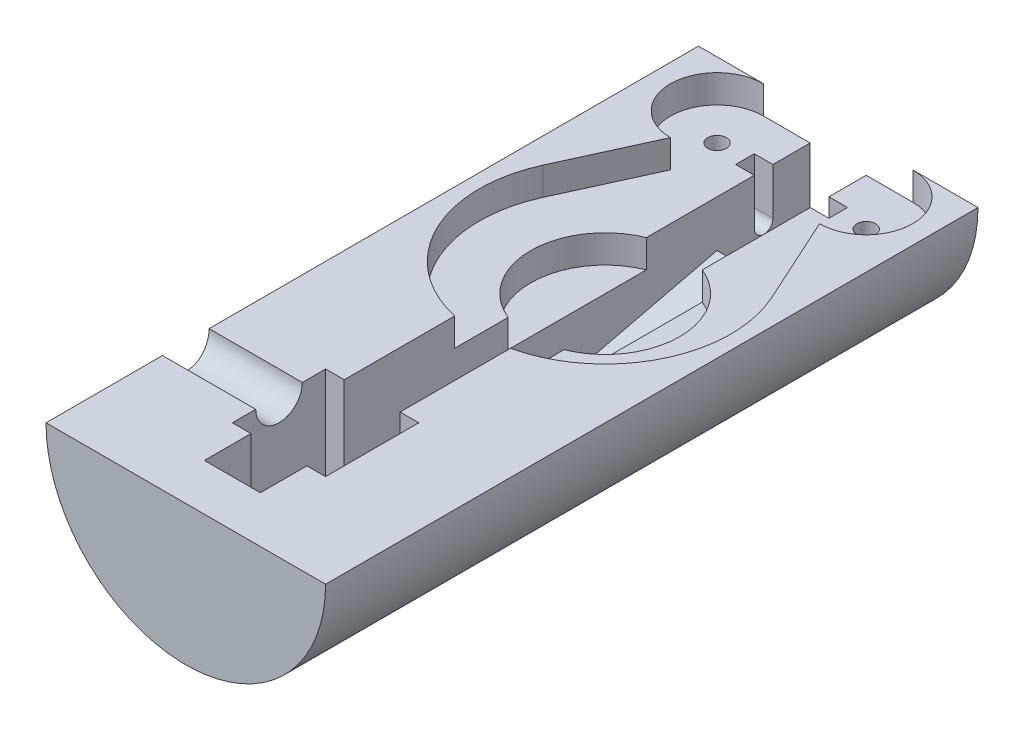
from build123d import *

# Parameters (mm, degrees)
SALIENTE_EXTRUIR1_DEPTH      = 35
SALIENTE_EXTRUIR1_DEPTH_BACK = 35
CORTAR_EXTRUIR1_DEPTH        = 3
CROQUIS4_R                   = 8
CORTAR_EXTRUIR2_DEPTH        = 3
CROQUIS5_R                   = 2.5
CORTAR_EXTRUIR3_DEPTH        = 10
CROQUIS6_W                   = 6
CROQUIS6_H                   = 10
CORTAR_EXTRUIR5_DEPTH        = 10
CROQUIS7_W                   = 2
CROQUIS7_H                   = 2
CORTAR_EXTRUIR6_DEPTH        = 5
CROQUIS8_R                   = 1
CORTAR_EXTRUIR7_DEPTH        = 2
CROQUIS9_W                   = 6
CROQUIS9_H                   = 10
CORTAR_EXTRUIR8_DEPTH        = 12
CORTAR_EXTRUIR9_DEPTH        = 5
CORTAR_EXTRUIR9_DEPTH_BACK   = 5
CROQUIS10_R                  = 1
CORTAR_EXTRUIR10_DEPTH       = 5
CORTAR_EXTRUIR10_DEPTH_BACK  = 5
CORTAR_EXTRUIR11_DEPTH       = 3
CORTAR_EXTRUIR11_DEPTH_BACK  = 3
CROQUIS15_R                  = 2.5
CORTAR_EXTRUIR12_DEPTH       = 15
CROQUIS14_W                  = 2
CROQUIS14_H                  = 10
CORTAR_EXTRUIR13_DEPTH       = 10


with BuildPart() as part:
    # Croquis1 → Saliente-Extruir1 (new, two sides: drawn at the far end of the back side and taken through both)
    with BuildSketch(Plane.XY.offset(-SALIENTE_EXTRUIR1_DEPTH_BACK)):
        with BuildLine():
            Line((-15, 0), (15, 0))
            ThreePointArc((15, 0), (0, -15), (-15, 0))
        make_face()
    extrude(amount=SALIENTE_EXTRUIR1_DEPTH + SALIENTE_EXTRUIR1_DEPTH_BACK)

    # Croquis3 → Cortar-Extruir1 (cut)
    with BuildSketch(Plane(origin=(0, 0, 0), x_dir=(1, 0, 0), z_dir=(0, 1, 0))):
        with BuildLine():
            Line((-8, 25), (-12.284525276, 15.598253186))
            ThreePointArc((-12.284525276, 15.598253186), (0, -3.5), (12.284525276, 15.598253186))
            Line((12.284525276, 15.598253186), (8, 25))
            ThreePointArc((8, 25), (13, 30), (8, 35))
            Line((8, 35), (-8, 35))
            ThreePointArc((-8, 35), (-13, 30), (-8, 25))
        make_face()
    extrude(amount=-CORTAR_EXTRUIR1_DEPTH, mode=Mode.SUBTRACT)

    # Croquis4 → Cortar-Extruir2 (cut)
    with BuildSketch(Plane(origin=(0, -3, 0), x_dir=(1, 0, 0), z_dir=(0, 1, 0))):
        with Locations((0, 10)):
            Circle(CROQUIS4_R)
    extrude(amount=-CORTAR_EXTRUIR2_DEPTH, mode=Mode.SUBTRACT)

    # Croquis5 → Cortar-Extruir3 (cut)
    with BuildSketch(Plane(origin=(0, -6, 0), x_dir=(1, 0, 0), z_dir=(0, 1, 0))):
        with Locations((0, 10)):
            Circle(CROQUIS5_R)
    extrude(amount=-CORTAR_EXTRUIR3_DEPTH, mode=Mode.SUBTRACT)

    # Croquis6 → Cortar-Extruir5 (cut)
    with BuildSketch(Plane(origin=(0, -3, 0), x_dir=(1, 0, 0), z_dir=(0, 1, 0))):
        with Locations((0, 30)):
            Rectangle(CROQUIS6_W, CROQUIS6_H)
    extrude(amount=-CORTAR_EXTRUIR5_DEPTH, mode=Mode.SUBTRACT)

    # Croquis7 → Cortar-Extruir6 (cut)
    with BuildSketch(Plane(origin=(0, -3, 0), x_dir=(1, 0, 0), z_dir=(0, 1, 0))):
        with Locations((-4, 30)):
            Rectangle(CROQUIS7_W, CROQUIS7_H)
        with Locations((4, 30)):
            Rectangle(CROQUIS7_W, CROQUIS7_H)
    extrude(amount=-CORTAR_EXTRUIR6_DEPTH, mode=Mode.SUBTRACT)

    # Croquis8 → Cortar-Extruir7 (cut)
    with BuildSketch(Plane(origin=(0, -3, 0), x_dir=(1, 0, 0), z_dir=(0, 1, 0))):
        with Locations((-8, 30)):
            Circle(CROQUIS8_R)
        with Locations((8, 30)):
            Circle(CROQUIS8_R)
    extrude(amount=-CORTAR_EXTRUIR7_DEPTH, mode=Mode.SUBTRACT)

    # Croquis9 → Cortar-Extruir8 (cut)
    with BuildSketch(Plane(origin=(0, -3, 0), x_dir=(1, 0, 0), z_dir=(0, 1, 0))):
        Rectangle(CROQUIS9_W, CROQUIS9_H)
    extrude(amount=-CORTAR_EXTRUIR8_DEPTH, mode=Mode.SUBTRACT)

    # Croquis10 → Cortar-Extruir9 (cut, two sides: drawn at the far end of the back side and taken through both)
    with BuildSketch(Plane(origin=(0, 0, 0), x_dir=(0, 0, -1), z_dir=(1, 0, 0)).offset(-CORTAR_EXTRUIR9_DEPTH_BACK)):
        with Locations((30, -8)):
            Circle(CROQUIS10_R)
    extrude(amount=CORTAR_EXTRUIR9_DEPTH + CORTAR_EXTRUIR9_DEPTH_BACK, mode=Mode.SUBTRACT)

    # Croquis11 → Cortar-Extruir10 (cut, two sides: drawn at the far end of the back side and taken through both)
    with BuildSketch(Plane(origin=(0, 0, 0), x_dir=(0, 0, -1), z_dir=(1, 0, 0)).offset(-CORTAR_EXTRUIR10_DEPTH_BACK)):
        with BuildLine():
            Line((-6, -15), (6, -15))
            Line((6, -15), (6, -14))
            Line((6, -14), (1, -14))
            Line((1, -14), (1, -8))
            ThreePointArc((1, -8), (0, -7), (-1, -8))
            Line((-1, -8), (-1, -14))
            Line((-1, -14), (-6, -14))
            Line((-6, -14), (-6, -15))
        make_face()
    extrude(amount=CORTAR_EXTRUIR10_DEPTH + CORTAR_EXTRUIR10_DEPTH_BACK, mode=Mode.SUBTRACT)

    # Croquis12 → Cortar-Extruir11 (cut, two sides: drawn at the far end of the back side and taken through both)
    with BuildSketch(Plane(origin=(0, 0, 0), x_dir=(0, 0, -1), z_dir=(1, 0, 0)).offset(-CORTAR_EXTRUIR11_DEPTH_BACK)):
        with BuildLine():
            Line((-3, -13), (-21.658767316, -9.861464952))
            ThreePointArc((-21.658767316, -9.861464952), (-27.635040051, -6.458030924), (-30, 0))
            Line((-30, 0), (-3, 0))
            Line((-3, 0), (-3, -13))
        make_face()
        Polygon((25, -8), (25, -3), (4, -3), (4, -13), align=None)
    extrude(amount=CORTAR_EXTRUIR11_DEPTH + CORTAR_EXTRUIR11_DEPTH_BACK, mode=Mode.SUBTRACT)

    # Croquis15 → Cortar-Extruir12 (cut)
    with BuildSketch(Plane(origin=(0, 0, 0), x_dir=(0, 0, -1), z_dir=(1, 0, 0))):
        with Locations((-20, 0)):
            Circle(CROQUIS15_R)
    extrude(amount=-CORTAR_EXTRUIR12_DEPTH, mode=Mode.SUBTRACT)

    # Croquis14 → Cortar-Extruir13 (cut)
    with BuildSketch(Plane(origin=(0, 0, 0), x_dir=(1, 0, 0), z_dir=(0, 1, 0))):
        with Locations((4, -20)):
            Rectangle(CROQUIS14_W, CROQUIS14_H)
        with Locations((-4, -20)):
            Rectangle(CROQUIS14_W, CROQUIS14_H)
    extrude(amount=-CORTAR_EXTRUIR13_DEPTH, mode=Mode.SUBTRACT)


solid = part.part
